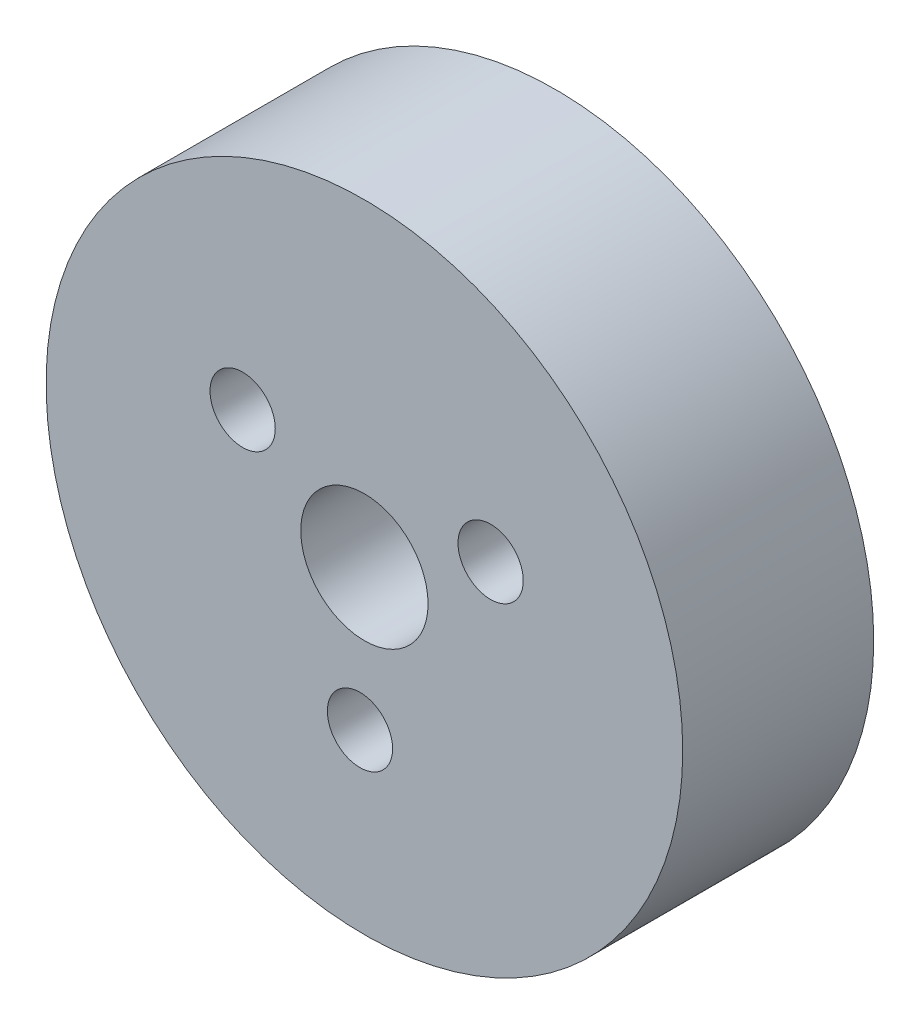
from build123d import *

# Parameters (mm, degrees)
SKETCH1_R                    = 10
SKETCH1_R_2                  = 2
BOSS_EXTRUDE1_DEPTH          = 6
F_2_05_2_05_DIAMETER_HOLE1_D = 2.05


with BuildPart() as part:
    # Sketch1 → Boss-Extrude1 (new body)
    with BuildSketch(Plane.XY):
        Circle(SKETCH1_R)
        Circle(SKETCH1_R_2, mode=Mode.SUBTRACT)
    extrude(amount=BOSS_EXTRUDE1_DEPTH)

    # Ø2.05 (2.05) Diameter Hole1 (through all)
    with Locations(Plane(origin=(-167.340510867, 18.18779669, 6.7366), x_dir=(0.05861513275015712, -0.9982806550327825, 0), z_dir=(0, 0, 1))):
        with Locations((32.447172363, 165.584185204), (25.375630841, 162.306487764), (26.072832352, 170.069471085)):
            Hole(F_2_05_2_05_DIAMETER_HOLE1_D / 2)


solid = part.part
